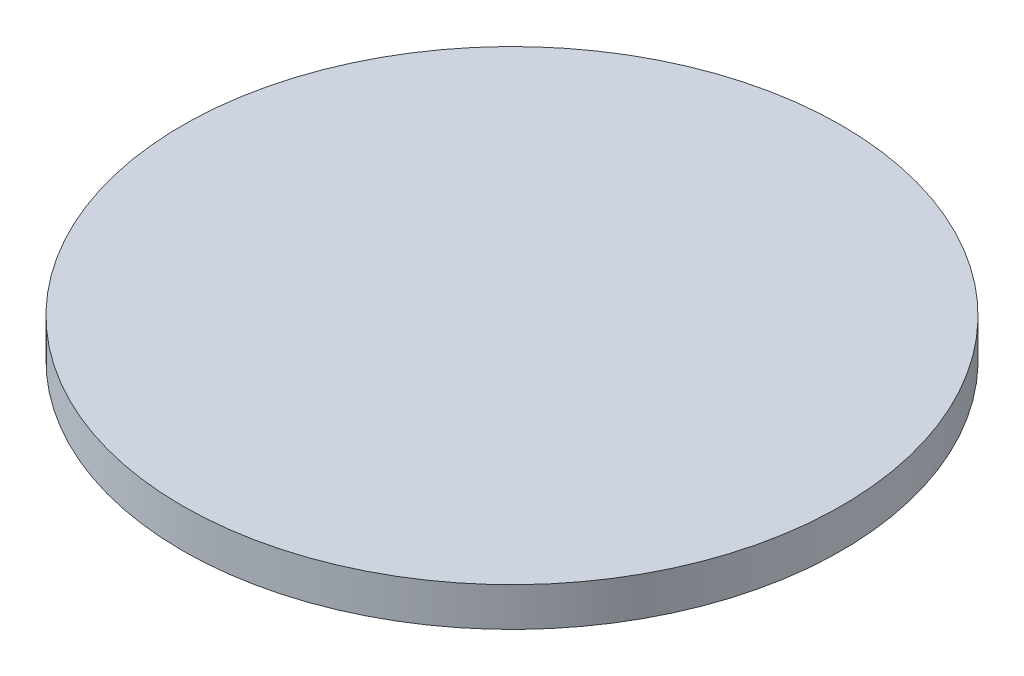
from build123d import *

# Parameters (mm, degrees)
PRESS_PZP400_ALT_PLAKA_D340_START = 890
SKETCH1_R                         = 170
PRESS_PZP400_ALT_PLAKA_D340_DEPTH = 20


with BuildPart() as part:
    # Sketch1 → PRESS_PZP400_alt_plaka_D340 (new body)
    with BuildSketch(Plane(origin=(0, 0, 0), x_dir=(1, 0, 0), z_dir=(0, 1, 0)).offset(PRESS_PZP400_ALT_PLAKA_D340_START)):
        with Locations(Location((350, 280, 0), (0, 0, 270))):
            Circle(SKETCH1_R)
    extrude(amount=PRESS_PZP400_ALT_PLAKA_D340_DEPTH)


solid = part.part
